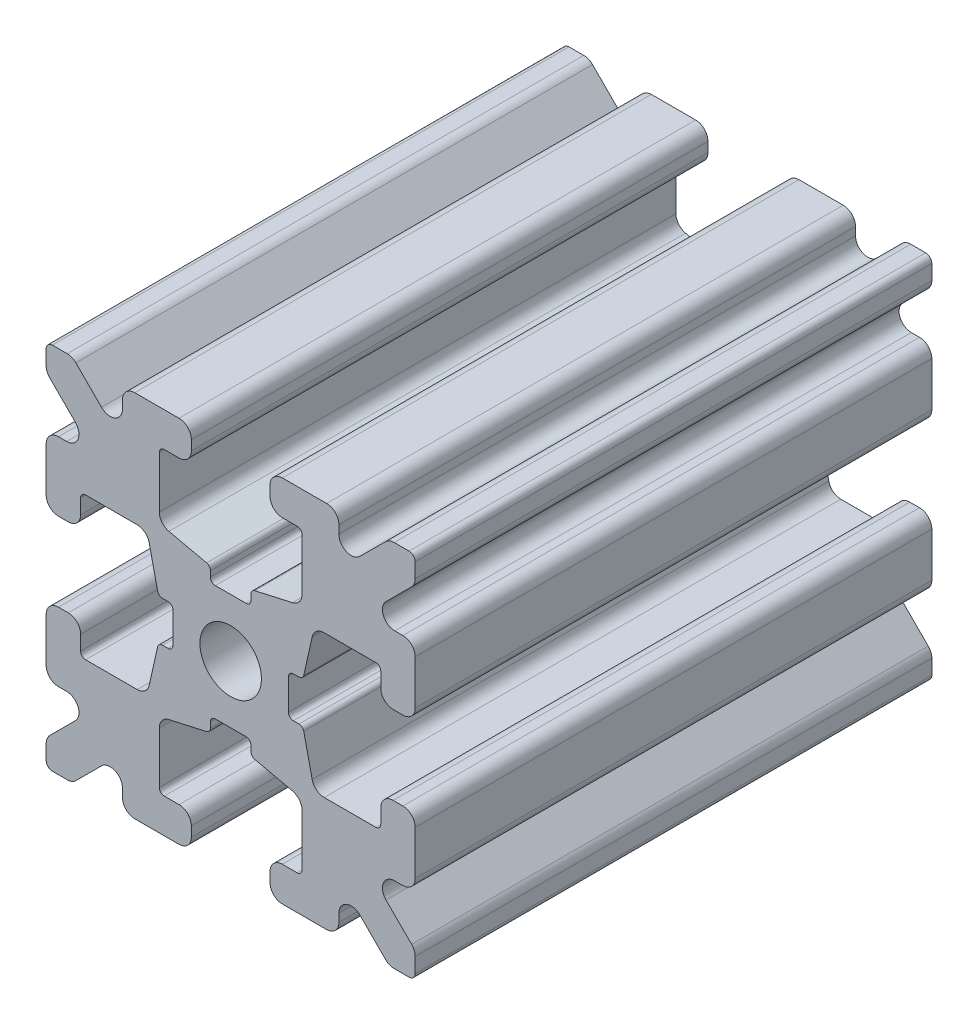
from build123d import *

# Parameters (mm, degrees)
SKETCH1_W           = 15
SKETCH1_H           = 15
SKETCH1_R           = 1.25
BOSS_EXTRUDE1_DEPTH = 10.5
FILLET1_R           = 0.25
CUT_EXTRUDE1_DEPTH  = 24.526580712
CUT_EXTRUDE3_DEPTH  = 24.526580712
FILLET3_R           = 0.5
FILLET4_R           = 0.5
FILLET5_R           = 3
FILLET6_R           = 0.2
CUT_EXTRUDE4_DEPTH  = 24.526580712
FILLET8_R           = 0.5
SKETCH6_W           = 5.1529354
SKETCH6_H           = 1.651
SKETCH6_W_2         = 1.651
SKETCH6_H_2         = 5.1529354
CUT_EXTRUDE5_DEPTH  = 24.526580712
FILLET10_R          = 0.2


with BuildPart() as part:
    # Sketch1 → Boss-Extrude1 (new, symmetric)
    with BuildSketch(Plane.XY):
        Rectangle(SKETCH1_W, SKETCH1_H)
        with Locations(Location((0, 0, 0), (0, 0, 180))):
            Circle(SKETCH1_R, mode=Mode.SUBTRACT)
    extrude(amount=BOSS_EXTRUDE1_DEPTH, both=True)

    # Fillet1
    fillet1_edges = [part.edges().sort_by_distance(p)[0] for p in [
        (7.5, -7.5, 0),
        (-7.5, -7.5, 0),
        (-7.5, 7.5, 0),
        (7.5, 7.5, 0),
    ]]
    fillet(fillet1_edges, radius=FILLET1_R)

    # Sketch2 → Cut-Extrude1 (cut, through all)
    with BuildSketch(Plane.XY.offset(10.5)):
        Polygon((-7.5, 1.6), (-6.1, 1.6), (-6.1, 2.9), (-3.4, 2.9), (-3.4, -2.9), (-6.1, -2.9), (-6.1, -1.6), (-7.5, -1.6), align=None)
        Polygon((2.9, 6.1), (1.6, 6.1), (1.6, 7.5), (-1.6, 7.5), (-1.6, 6.1), (-2.9, 6.1), (-2.9, 3.4), (2.9, 3.4), align=None)
        Polygon((-1.6, -7.5), (-1.6, -6.1), (-2.9, -6.1), (-2.9, -3.4), (2.9, -3.4), (2.9, -6.1), (1.6, -6.1), (1.6, -7.5), align=None)
        Polygon((6.1, -2.9), (6.1, -1.6), (7.5, -1.6), (7.5, 1.6), (6.1, 1.6), (6.1, 2.9), (3.4, 2.9), (3.4, -2.9), align=None)
    extrude(amount=-CUT_EXTRUDE1_DEPTH, mode=Mode.SUBTRACT)

    # Sketch4 → Cut-Extrude3 (cut, through all)
    with BuildSketch(Plane.XY.offset(10.5)):
        Polygon((-3.4, 2.9), (-2.75, 0), (-3.4, -2.9), align=None)
        Polygon((-2.9, 3.4), (0, 2.75), (2.9, 3.4), align=None)
        Polygon((3.4, 2.9), (2.75, 0), (3.4, -2.9), align=None)
        Polygon((-2.9, -3.4), (0, -2.75), (2.9, -3.4), align=None)
    extrude(amount=-CUT_EXTRUDE3_DEPTH, mode=Mode.SUBTRACT)

    # Fillet3
    fillet3_edges = [part.edges().sort_by_distance(p)[0] for p in [
        (1.6, -7.5, 0),
        (-1.6, -7.5, 0),
        (-1.6, -6.1, 0),
        (1.6, -6.1, 0),
        (6.1, 1.6, 0),
        (7.5, 1.6, 0),
        (7.5, -1.6, 0),
        (6.1, -1.6, 0),
        (-7.5, -1.6, 0),
        (-7.5, 1.6, 0),
        (-6.1, 1.6, 0),
        (-6.1, -1.6, 0),
        (-1.6, 6.1, 0),
        (-1.6, 7.5, 0),
        (1.6, 7.5, 0),
        (1.6, 6.1, 0),
    ]]
    fillet(fillet3_edges, radius=FILLET3_R)

    # Fillet4
    fillet4_edges = [part.edges().sort_by_distance(p)[0] for p in [
        (-2.9, -3.4, 0),
        (2.9, -3.4, 0),
        (3.4, -2.9, 0),
        (3.4, 2.9, 0),
        (-3.4, 2.9, 0),
        (-3.4, -2.9, 0),
        (2.9, 3.4, 0),
        (-2.9, 3.4, 0),
    ]]
    fillet(fillet4_edges, radius=FILLET4_R)

    # Fillet5
    fillet5_edges = [part.edges().sort_by_distance(p)[0] for p in [
        (-2.75, 0, 0),
        (0, 2.75, 0),
        (2.75, 0, 0),
        (0, -2.75, 0),
    ]]
    fillet(fillet5_edges, radius=FILLET5_R)

    # Fillet6
    fillet6_edges = [part.edges().sort_by_distance(p)[0] for p in [
        (-2.9, -6.1, 0),
        (2.9, -6.1, 0),
        (6.1, -2.9, 0),
        (6.1, 2.9, 0),
        (-6.1, 2.9, 0),
        (-6.1, -2.9, 0),
        (2.9, 6.1, 0),
        (-2.9, 6.1, 0),
    ]]
    fillet(fillet6_edges, radius=FILLET6_R)

    # Sketch5 → Cut-Extrude4 (cut, through all)
    with BuildSketch(Plane.XY.offset(10.5)):
        Polygon((-7.5, 6.439339828), (-5.460660172, 4.4), (-7.5, 4.4), align=None)
        Polygon((-6.439339828, 7.5), (-4.4, 5.460660172), (-4.4, 7.5), align=None)
        Polygon((4.4, 7.5), (6.439339828, 7.5), (4.4, 5.460660172), align=None)
        Polygon((7.5, 6.439339828), (7.5, 4.4), (5.460660172, 4.4), align=None)
        Polygon((7.5, -6.439339828), (5.460660172, -4.4), (7.5, -4.4), align=None)
        Polygon((6.439339828, -7.5), (4.4, -5.460660172), (4.4, -7.5), align=None)
        Polygon((-4.4, -7.5), (-6.439339828, -7.5), (-4.4, -5.460660172), align=None)
        Polygon((-7.5, -6.439339828), (-7.5, -4.4), (-5.460660172, -4.4), align=None)
    extrude(amount=-CUT_EXTRUDE4_DEPTH, mode=Mode.SUBTRACT)

    # Fillet8
    fillet8_edges = [part.edges().sort_by_distance(p)[0] for p in [
        (-7.5, 4.4, 0),
        (-7.5, 6.439339828, 0),
        (-5.460660172, 4.4, 0),
        (7.5, -4.4, 0),
        (7.5, -6.439339828, 0),
        (5.460660172, -4.4, 0),
        (5.460660172, 4.4, 0),
        (7.5, 6.439339828, 0),
        (7.5, 4.4, 0),
        (-4.4, 7.5, 0),
        (-4.4, 5.460660172, 0),
        (-6.439339828, 7.5, 0),
        (-5.460660172, -4.4, 0),
        (-7.5, -6.439339828, 0),
        (-7.5, -4.4, 0),
        (4.4, 5.460660172, 0),
        (4.4, 7.5, 0),
        (6.439339828, 7.5, 0),
        (6.439339828, -7.5, 0),
        (4.4, -7.5, 0),
        (4.4, -5.460660172, 0),
        (-6.439339828, -7.5, 0),
        (-4.4, -5.460660172, 0),
        (-4.4, -7.5, 0),
    ]]
    fillet(fillet8_edges, radius=FILLET8_R)

    # Sketch6 → Cut-Extrude5 (cut, through all)
    with BuildSketch(Plane.XY.offset(10.5)):
        with Locations((4.9235323, 0)):
            Rectangle(SKETCH6_W, SKETCH6_H)
        with Locations((0, -4.9235323)):
            Rectangle(SKETCH6_W_2, SKETCH6_H_2)
        with Locations((-4.9235323, 0)):
            Rectangle(SKETCH6_W, SKETCH6_H)
        with Locations((0, 4.9235323)):
            Rectangle(SKETCH6_W_2, SKETCH6_H_2)
    extrude(amount=-CUT_EXTRUDE5_DEPTH, mode=Mode.SUBTRACT)

    # Fillet10
    fillet10_edges = [part.edges().sort_by_distance(p)[0] for p in [
        (0.8255, -2.935025862, 0),
        (-0.8255, -2.935025862, 0),
        (0.8255, -2.3470646, 0),
        (-0.8255, -2.3470646, 0),
        (2.935025862, 0.8255, 0),
        (2.935025862, -0.8255, 0),
        (2.3470646, 0.8255, 0),
        (2.3470646, -0.8255, 0),
        (-2.935025862, -0.8255, 0),
        (-2.935025862, 0.8255, 0),
        (-2.3470646, -0.8255, 0),
        (-2.3470646, 0.8255, 0),
        (-0.8255, 2.935025862, 0),
        (0.8255, 2.935025862, 0),
        (-0.8255, 2.3470646, 0),
        (0.8255, 2.3470646, 0),
    ]]
    fillet(fillet10_edges, radius=FILLET10_R)


solid = part.part
